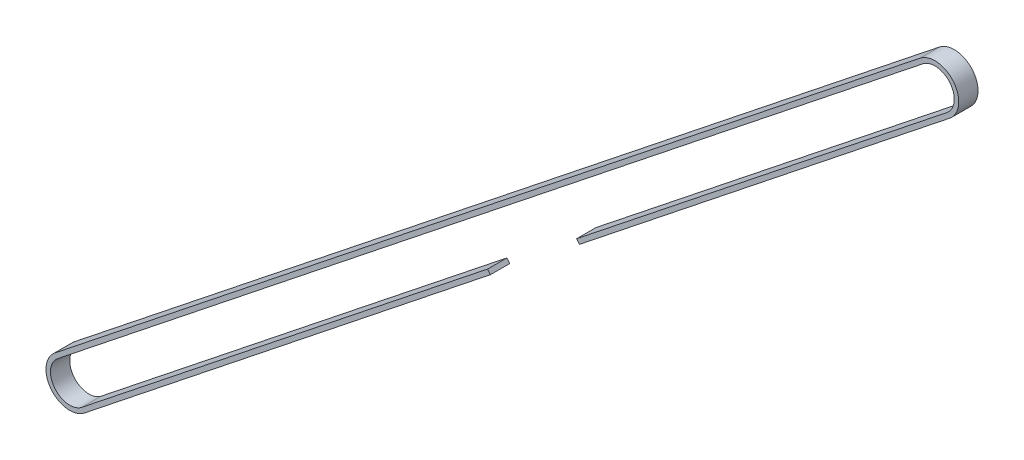
from build123d import *

# Parameters (mm, degrees)
EXTRUDE_1_DEPTH = 6


with BuildPart() as part:
    # Эскиз1 → Бобышка-Вытянуть1 (new body)
    with BuildSketch(Plane(origin=(0, 0, 0), x_dir=(-1, 0, 0), z_dir=(0, 0, -1))):
        with BuildLine():
            Line((-265.446108594, 218.715019647), (3.734050958, 4.696473511))
            ThreePointArc((3.734050958, 4.696473511), (4.696473511, -3.734050958), (-3.734050958, -4.696473511))
            Line((-3.734050958, -4.696473511), (-130, 95.694487269))
            Line((-130, 95.694487269), (-130.871278557, 94.598643449))
            Line((-130.871278557, 94.598643449), (-4.605329515, -5.79231733))
            ThreePointArc((-4.605329515, -5.79231733), (5.79231733, -4.605329515), (4.605329515, 5.79231733))
            Line((4.605329515, 5.79231733), (-264.574830037, 219.810863466))
            ThreePointArc((-264.574830037, 219.810863466), (-274.972476883, 218.623875651), (-273.785489068, 208.226228806))
            Line((-273.785489068, 208.226228806), (-158.550793978, 116.60594762))
            Line((-158.550793978, 116.60594762), (-157.679515421, 117.70179144))
            Line((-157.679515421, 117.70179144), (-272.914210511, 209.322072625))
            ThreePointArc((-272.914210511, 209.322072625), (-273.876633064, 217.752597094), (-265.446108594, 218.715019647))
        make_face()
    extrude(amount=-EXTRUDE_1_DEPTH)


solid = part.part
